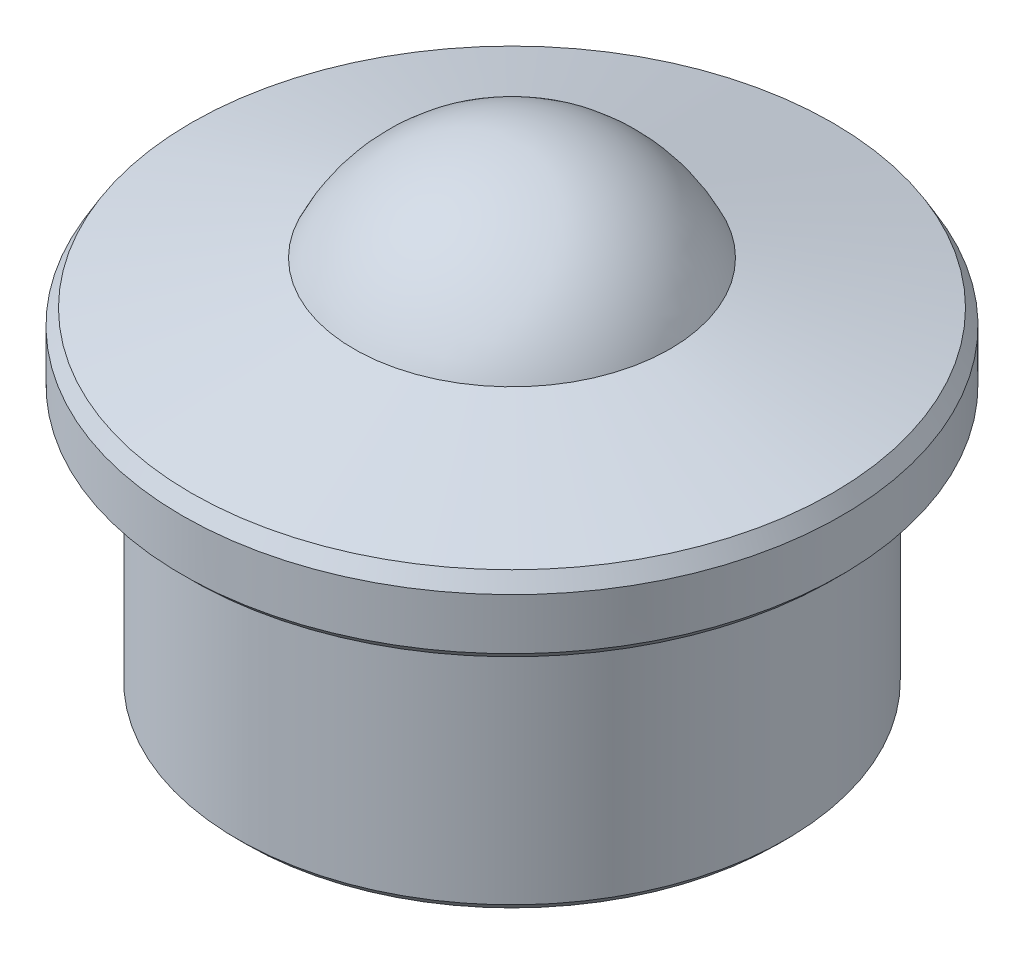
from build123d import *
from OCP.BRepFilletAPI import BRepFilletAPI_MakeChamfer

# Parameters (mm, degrees)
CHAMFER_1_SIZE  = 0.5
CHAMFER_1_SIZE2 = 0.70589663


with BuildPart() as part:
    # 草图2 → 旋转1 (revolve)
    with BuildSketch(Plane.XY, mode=Mode.PRIVATE) as revolve_1_sk:
        with BuildLine():
            Line((0, 0), (0, 26))
            ThreePointArc((0, 26), (5.117983001, 24.508173408), (8.63278634, 20.5))
            Line((8.63278634, 20.5), (18, 18))
            Line((18, 18), (18, 14))
            Line((18, 14), (15, 14))
            Line((15, 14), (15, 0))
            Line((15, 0), (0, 0))
        make_face()
    revolve(revolve_1_sk.sketch.rotate(Axis((0, 0, 0), (0, 1, 0)), 90), axis=Axis((0, 0, 0), (0, 1, 0)))

    # 倒角1: one chamfer whose edges measure the first distance from different faces: ONE call of the kernel's chamfer builder (chamfer() names one face for all edges)
    chamfer_1_edges_1 = [part.edges().sort_by_distance(p)[0] for p in [
        (0, 18, 18),
    ]]
    chamfer_1_side_1 = [part.faces().sort_by_distance(p)[0] for p in [
        (0, 19.25, 13.31639317),
    ]]
    chamfer_1_edges_2 = [part.edges().sort_by_distance(p)[0] for p in [
        (0, 14, 18),
        (0, 0, 15),
    ]]
    chamfer_1 = BRepFilletAPI_MakeChamfer(part.part.solid().wrapped)
    for e in chamfer_1_edges_1:
        chamfer_1.Add(CHAMFER_1_SIZE, CHAMFER_1_SIZE2, e.wrapped, chamfer_1_side_1[0].wrapped)  # the first distance lies on this face
    for e in chamfer_1_edges_2:
        chamfer_1.Add(CHAMFER_1_SIZE, e.wrapped)
    add(Compound.cast(chamfer_1.Shape()), mode=Mode.REPLACE)


solid = part.part
